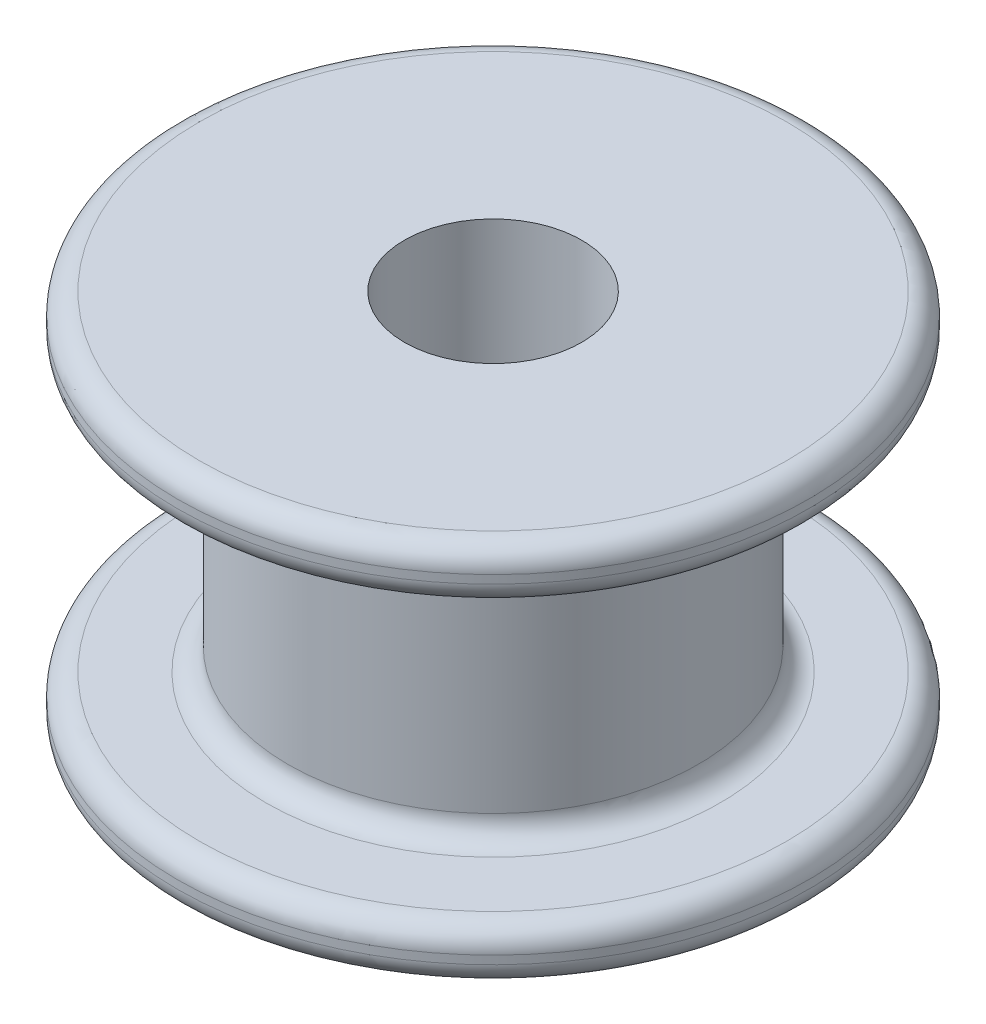
from build123d import *


with BuildPart() as part:
    # Sketch3 → Revolve1 (revolve)
    with BuildSketch(Plane(origin=(0, 0, 0), x_dir=(0, 0, -1), z_dir=(1, 0, 0)), mode=Mode.PRIVATE) as revolve1_sk:
        with BuildLine():
            Line((8, 0), (8, 17.25))
            Line((8, 17.25), (26.5, 17.25))
            ThreePointArc((26.5, 17.25), (27.914213562, 16.664213562), (28.5, 15.25))
            Line((28.5, 15.25), (28.5, 14.5))
            ThreePointArc((28.5, 14.5), (27.914213562, 13.085786438), (26.5, 12.5))
            Line((26.5, 12.5), (20.5, 12.5))
            ThreePointArc((20.5, 12.5), (19.085786438, 11.914213562), (18.5, 10.5))
            Line((18.5, 10.5), (18.5, 0))
            Line((18.5, 0), (8, 0))
        make_face()
    revolve1 = revolve(revolve1_sk.sketch.rotate(Axis((0, 18.1125, 0), (0, -1, 0)), 180), axis=Axis((0, 18.1125, 0), (0, -1, 0)))

    # Mirror1: Revolve1 across plane
    add(revolve1.mirror(Plane(origin=(0, 0, -18.5), x_dir=(0, 0, 1), z_dir=(0, 1, 0))))


solid = part.part
